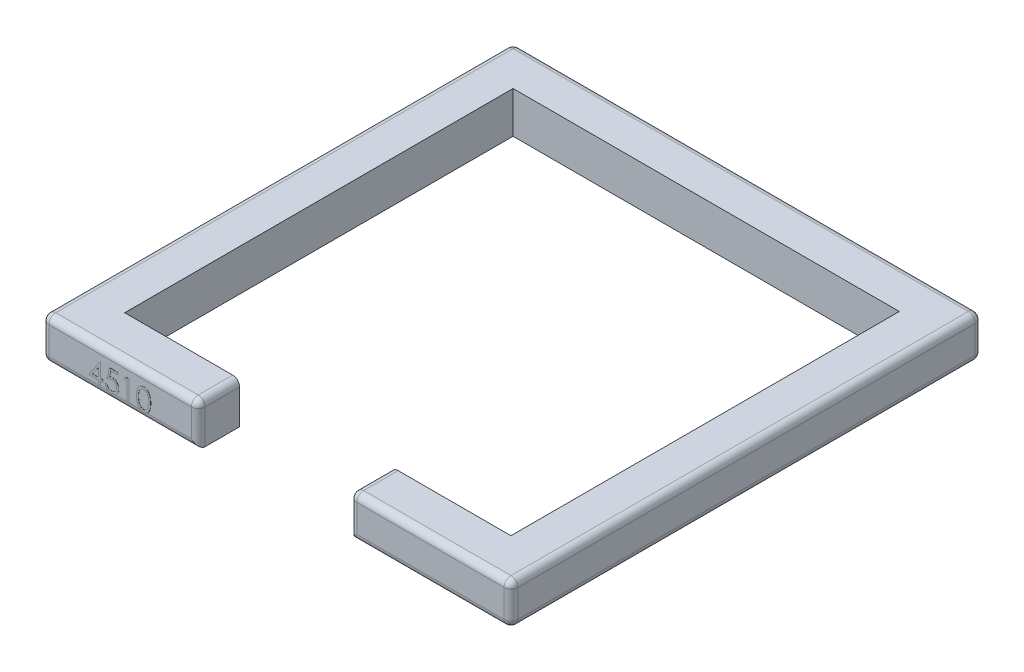
from build123d import *

# Parameters (mm, degrees)
SKETCH2_W           = 863.6
SKETCH2_H           = 867.537
SKETCH2_W_2         = 711.2
SKETCH2_H_2         = 715.137
BOSS_EXTRUDE1_DEPTH = 76.2
SKETCH4_W           = 279.4
SKETCH4_H           = 76.2
CUT_EXTRUDE1_DEPTH  = 617.776127612
FILLET1_R           = 12.7
BOSS_EXTRUDE2_DEPTH = 0.254


with BuildPart() as part:
    # Sketch2 → Boss-Extrude1 (new body)
    with BuildSketch(Plane(origin=(0, 0, 0), x_dir=(1, 0, 0), z_dir=(0, 1, 0))):
        Rectangle(SKETCH2_W, SKETCH2_H)
        Rectangle(SKETCH2_W_2, SKETCH2_H_2, mode=Mode.SUBTRACT)
    extrude(amount=-BOSS_EXTRUDE1_DEPTH)

    # Sketch4 → Cut-Extrude1 (cut, through all)
    with BuildSketch(Plane(origin=(0, 0, 0), x_dir=(1, 0, 0), z_dir=(0, 1, 0))):
        with Locations((-4.378537139, -395.6685)):
            Rectangle(SKETCH4_W, SKETCH4_H)
    extrude(amount=-CUT_EXTRUDE1_DEPTH, mode=Mode.SUBTRACT)

    # Fillet1
    fillet1_edges = [part.edges().sort_by_distance(p)[0] for p in [
        (-431.8, -76.2, 0),
        (-287.93926857, -76.2, 433.7685),
        (283.56073143, 0, 433.7685),
        (283.56073143, -76.2, 433.7685),
        (135.321462861, -38.1, 433.7685),
        (-144.078537139, -38.1, 433.7685),
        (135.321462861, 0, 395.6685),
        (-144.078537139, 0, 395.6685),
        (431.8, -76.2, 0),
        (-287.93926857, 0, 433.7685),
        (-431.8, 0, 0),
        (0, 0, -433.7685),
        (431.8, 0, 0),
        (431.8, -38.1, 433.7685),
        (-431.8, -38.1, 433.7685),
        (-431.8, -38.1, -433.7685),
        (431.8, -38.1, -433.7685),
        (0, -76.2, -433.7685),
    ]]
    fillet(fillet1_edges, radius=FILLET1_R)

    # Sketch5 → Boss-Extrude2 (add)
    # profile 1 of 4: a face of its own
    with BuildSketch(Plane.XY.offset(433.7685)):
        Polygon((-324.291492127, -24.423076923), (-323.596960877, -24.423076923), (-323.596960877, -50.8), (-319.200807031, -50.8), (-319.200807031, -54.707692308), (-323.596960877, -54.707692308), (-323.596960877, -63.5), (-327.016191647, -63.5), (-327.016191647, -54.707692308), (-345.08926857, -54.707692308), align=None)
        Polygon((-327.016191647, -50.8), (-327.016191647, -34.253365385), (-338.372922416, -50.8), align=None, mode=Mode.SUBTRACT)
    # profile 2 of 4: a face of its own
    with BuildSketch(Plane.XY.offset(433.7685)):
        with BuildLine():
            Line((-291.846960877, -25.4), (-291.846960877, -29.307692308))
            Line((-291.846960877, -29.307692308), (-304.80645607, -29.307692308))
            Line((-304.80645607, -29.307692308), (-306.859520974, -39.328786058))
            add(Edge.make_bspline(
                [(-306.859520974, -39.328786058), (-306.456141312, -39.217422242), (-305.674657018, -39.001672462), (-304.521208246, -38.762123932), (-303.426190259, -38.617720098), (-302.715621227, -38.598002689), (-302.371780589, -38.588461538)],
                knots=[0, 0, 0, 0, 1.100273476, 2.13160584, 3.095893838, 4, 4, 4, 4], degree=3))
            add(Edge.make_bspline(
                [(-302.371780589, -38.588461538), (-301.946326165, -38.597670153), (-301.109776469, -38.615776589), (-299.885798217, -38.789641579), (-298.717403008, -39.063307507), (-297.60703435, -39.445619472), (-296.55263807, -39.934493996), (-295.563915186, -40.545181918), (-294.626024762, -41.258559037), (-293.755792525, -42.07874331), (-292.966313628, -42.981404338), (-292.272175283, -43.951951449), (-291.6825768, -44.980952571), (-291.208386868, -46.078239198), (-290.829734544, -47.231680268), (-290.577708543, -48.453412095), (-290.409886654, -49.731918773), (-290.391137248, -50.606091378), (-290.381576262, -51.051862981)],
                knots=[0, 0, 0, 0, 1.052922333, 2.070308379, 3.05430497, 4.020497103, 4.973039431, 5.925935799, 6.892292201, 7.88610001, 8.88166317, 9.857072816, 10.836096531, 11.812156883, 12.81219415, 13.836441305, 14.89672472, 16, 16, 16, 16], degree=3))
            add(Edge.make_bspline(
                [(-290.381576262, -51.051862981), (-290.388816081, -51.362347722), (-290.40319788, -51.979121273), (-290.476334506, -52.895091), (-290.617149015, -53.791669269), (-290.806209097, -54.66897502), (-291.051599419, -55.525347329), (-291.348660263, -56.36323739), (-291.712199876, -57.177430109), (-292.110958561, -57.975629409), (-292.559955936, -58.739790302), (-293.058287688, -59.454426412), (-293.584780607, -60.130258162), (-294.15128826, -60.76003737), (-294.763076235, -61.339625651), (-295.412735303, -61.872462658), (-296.095081473, -62.367559425), (-296.820671396, -62.804818921), (-297.573336711, -63.207187101), (-298.363946732, -63.537280464), (-299.174504643, -63.832397927), (-300.016676574, -64.067633071), (-300.888554934, -64.251956021), (-301.791576919, -64.377148273), (-302.721006498, -64.468331778), (-303.351017349, -64.474039778), (-303.66925655, -64.476923077)],
                knots=[0, 0, 0, 0, 1.056347294, 2.098418968, 3.122841568, 4.141288669, 5.149314143, 6.15115421, 7.162517403, 8.180376062, 9.185164535, 10.17417709, 11.141909838, 12.097768115, 13.052685741, 14.0056014, 14.954263652, 15.917497458, 16.885230207, 17.854509472, 18.828990115, 19.81800267, 20.826176721, 21.857883937, 22.917946725, 24, 24, 24, 24], degree=3))
            add(Edge.make_bspline(
                [(-303.66925655, -64.476923077), (-304.048886918, -64.469402812), (-304.795764817, -64.454607579), (-305.89000299, -64.299829211), (-306.942810555, -64.078153436), (-307.945712514, -63.744655755), (-308.907696841, -63.326782633), (-309.815812712, -62.798649452), (-310.69326416, -62.200162637), (-311.504380903, -61.493893652), (-312.257194595, -60.721925799), (-312.931091163, -59.884186905), (-313.531259527, -58.99450355), (-314.048088716, -58.048555072), (-314.488938605, -57.048827064), (-314.835267477, -55.991573826), (-315.114794713, -54.882319497), (-315.233050804, -54.118648427), (-315.293114724, -53.730769231)],
                knots=[0, 0, 0, 0, 1.0467383, 2.05933395, 3.04377827, 4.011590433, 4.970194871, 5.932262533, 6.905835911, 7.896367577, 8.894135286, 9.877477877, 10.858688626, 11.851381753, 12.8477658, 13.868841284, 14.917554742, 16, 16, 16, 16], degree=3))
            Line((-315.293114724, -53.730769231), (-311.873883954, -53.730769231))
            add(Edge.make_bspline(
                [(-311.873883954, -53.730769231), (-311.789753087, -54.094095756), (-311.628048888, -54.792429512), (-311.273112023, -55.773573542), (-310.839143493, -56.647905662), (-310.3231133, -57.426991697), (-309.707525825, -58.10635821), (-309.005076899, -58.711789656), (-308.217520255, -59.257981778), (-307.342382528, -59.713252472), (-306.419131578, -60.101532331), (-305.452837092, -60.360086496), (-304.469809778, -60.541887644), (-303.804928091, -60.560085954), (-303.47081905, -60.569230769)],
                knots=[0, 0, 0, 0, 1.136247022, 2.183929868, 3.172523383, 4.106158343, 5.02341133, 5.958108904, 6.928429099, 7.938127109, 8.96079061, 9.975095812, 10.982467395, 12, 12, 12, 12], degree=3))
            add(Edge.make_bspline(
                [(-303.47081905, -60.569230769), (-303.144699984, -60.560296015), (-302.502568874, -60.542703412), (-301.557564922, -60.407295881), (-300.64520192, -60.198752033), (-299.774482408, -59.886660183), (-298.930169648, -59.507350534), (-298.13362089, -59.020594994), (-297.361792427, -58.460415936), (-296.638674745, -57.818630906), (-295.976393883, -57.111389374), (-295.391220108, -56.355078319), (-294.903791421, -55.548263504), (-294.493028693, -54.704912897), (-294.181117069, -53.815783461), (-293.958602388, -52.885042097), (-293.827940519, -51.910389884), (-293.809966246, -51.245606826), (-293.800807031, -50.906850962)],
                knots=[0, 0, 0, 0, 1.027316725, 2.022795036, 3.002884548, 3.971462791, 4.93288096, 5.914575861, 6.907176829, 7.935150275, 8.956128384, 9.956726525, 10.942570165, 11.921478529, 12.907843606, 13.90538589, 14.932640048, 16, 16, 16, 16], degree=3))
            add(Edge.make_bspline(
                [(-293.800807031, -50.906850962), (-293.807975051, -50.601226351), (-293.822005428, -50.003009662), (-293.936638208, -49.127806871), (-294.136031536, -48.299697468), (-294.412788629, -47.514682521), (-294.764174127, -46.77202162), (-295.193575413, -46.070948308), (-295.709050973, -45.420702866), (-296.297879818, -44.820981068), (-296.94294592, -44.267498287), (-297.655347804, -43.795666946), (-298.420177293, -43.398731157), (-299.228219504, -43.056179518), (-300.098694543, -42.810154261), (-301.01436417, -42.625446708), (-301.985116334, -42.518599474), (-302.648825824, -42.503774346), (-302.989989724, -42.496153846)],
                knots=[0, 0, 0, 0, 1.045622112, 2.046656509, 3.013763289, 3.955457236, 4.890082067, 5.820317437, 6.762574623, 7.722996705, 8.69280354, 9.665887285, 10.63943826, 11.638615906, 12.663482002, 13.728887084, 14.832589034, 16, 16, 16, 16], degree=3))
            add(Edge.make_bspline(
                [(-302.989989724, -42.496153846), (-303.285307491, -42.502473996), (-303.895063759, -42.515523501), (-304.830395102, -42.611606223), (-305.813285, -42.766611114), (-306.839965652, -42.979821408), (-307.913520326, -43.258833986), (-309.031683488, -43.593183265), (-310.196806162, -43.992928451), (-310.981859104, -44.294813406), (-311.385422416, -44.45)],
                knots=[0, 0, 0, 0, 0.817624296, 1.688186739, 2.600797293, 3.572016777, 4.590301741, 5.671205678, 6.80286297, 8, 8, 8, 8], degree=3))
            Line((-311.385422416, -44.45), (-307.477730108, -25.4))
            Line((-307.477730108, -25.4), (-291.846960877, -25.4))
        make_face()
    # profile 3 of 4: a face of its own
    with BuildSketch(Plane.XY.offset(433.7685)):
        Polygon((-278.376107512, -25.4), (-271.331576262, -25.4), (-271.331576262, -63.5), (-274.750807031, -63.5), (-274.750807031, -29.307692308), (-280.612345493, -29.307692308), align=None)
    # profile 4 of 4: a face of its own
    with BuildSketch(Plane.XY.offset(433.7685)):
        with BuildLine():
            add(Edge.make_bspline(
                [(-257.166191647, -44.465264423), (-257.162620935, -43.854604288), (-257.155684775, -42.668388174), (-257.07852225, -40.939903927), (-256.950339238, -39.318364781), (-256.774672408, -37.80369312), (-256.560898966, -36.395497912), (-256.275524669, -35.097542412), (-255.950991018, -33.903819266), (-255.574862965, -32.810435824), (-255.150453033, -31.8026614), (-254.688525795, -30.861861352), (-254.170749033, -29.989459174), (-253.626714638, -29.171530655), (-253.034400372, -28.42146472), (-252.41066211, -27.72866888), (-251.7311554, -27.109154711), (-251.018979224, -26.544770676), (-250.267685712, -26.050020713), (-249.498689832, -25.614235758), (-248.706698537, -25.241945775), (-247.889549517, -24.949224173), (-247.054587387, -24.707443241), (-246.198893318, -24.542100697), (-245.321054471, -24.438066921), (-244.728529423, -24.428120995), (-244.428030589, -24.423076923)],
                knots=[0, 0, 0, 0, 1.646270934, 3.197905019, 4.663502075, 6.030701355, 7.308322542, 8.50163776, 9.611534131, 10.641858119, 11.616356847, 12.558055219, 13.465016945, 14.349605745, 15.204443733, 16.039544428, 16.859896111, 17.680448484, 18.487036065, 19.28249412, 20.06191084, 20.843045899, 21.620316918, 22.403196591, 23.190181807, 24, 24, 24, 24], degree=3))
            add(Edge.make_bspline(
                [(-244.428030589, -24.423076923), (-244.125021523, -24.42838714), (-243.522431826, -24.43894749), (-242.631540884, -24.540445264), (-241.761231492, -24.70885949), (-240.915214039, -24.947484956), (-240.086539187, -25.243529322), (-239.281688578, -25.61459194), (-238.495662917, -26.046524753), (-237.740953216, -26.55405896), (-237.009274118, -27.119923167), (-236.318597721, -27.75959679), (-235.668861157, -28.466620877), (-235.051909976, -29.233430881), (-234.485247618, -30.074734233), (-233.945605398, -30.9758984), (-233.462584093, -31.952682957), (-232.997386629, -32.988790335), (-232.59584543, -34.112889021), (-232.233718589, -35.318642557), (-231.941121817, -36.620292991), (-231.697398595, -38.011010975), (-231.508587013, -39.495903864), (-231.371071681, -41.071788613), (-231.298430384, -42.739702008), (-231.284750294, -43.880066024), (-231.277730108, -44.465264423)],
                knots=[0, 0, 0, 0, 0.810914788, 1.612654377, 2.396697861, 3.181598691, 3.963628158, 4.749916497, 5.551656086, 6.361998678, 7.18212741, 8.025565596, 8.878627764, 9.750805457, 10.657531673, 11.591944965, 12.560506719, 13.57287815, 14.630710178, 15.753379473, 16.941251878, 18.199788006, 19.531962791, 20.947069417, 22.433333509, 24, 24, 24, 24], degree=3))
            add(Edge.make_bspline(
                [(-231.277730108, -44.465264423), (-231.284823071, -45.047910392), (-231.298643421, -46.183172303), (-231.370257343, -47.84358092), (-231.5113213, -49.411102477), (-231.687778601, -50.889496368), (-231.932173369, -52.272609304), (-232.232675322, -53.565227444), (-232.566325979, -54.772932909), (-232.978184738, -55.885831859), (-233.428969899, -56.919449185), (-233.919427891, -57.884654428), (-234.444879427, -58.789978928), (-235.01734548, -59.628176173), (-235.62752692, -60.40518384), (-236.288483421, -61.107286533), (-236.981583219, -61.751401562), (-237.715415517, -62.324552135), (-238.481895546, -62.826218151), (-239.265221498, -63.274860351), (-240.079292042, -63.636621974), (-240.905658756, -63.947246278), (-241.756141828, -64.184559768), (-242.629681109, -64.348649452), (-243.521833277, -64.463731574), (-244.124918886, -64.472510684), (-244.428030589, -64.476923077)],
                knots=[0, 0, 0, 0, 1.561518951, 3.042555995, 4.452378317, 5.7783523, 7.031515105, 8.214008947, 9.334062868, 10.386615937, 11.391082383, 12.354592575, 13.286541444, 14.194233754, 15.072674879, 15.931287219, 16.775624067, 17.606195743, 18.42308326, 19.229000347, 20.022332153, 20.807536673, 21.593273796, 22.3848459, 23.188221202, 24, 24, 24, 24], degree=3))
            add(Edge.make_bspline(
                [(-244.428030589, -64.476923077), (-244.728521087, -64.471846465), (-245.321029696, -64.461836376), (-246.198988956, -64.358272613), (-247.051149269, -64.191770136), (-247.881715706, -63.958635102), (-248.694949484, -63.673267884), (-249.479769062, -63.301480643), (-250.244900704, -62.873301206), (-250.988303071, -62.385671047), (-251.696006882, -61.826997868), (-252.371994557, -61.20907804), (-252.99928405, -60.516491763), (-253.583129491, -59.760174942), (-254.138018851, -58.947085647), (-254.648443172, -58.066122501), (-255.120565898, -57.120778655), (-255.552113611, -56.104946542), (-255.934731919, -55.003802899), (-256.272708399, -53.804750413), (-256.539562513, -52.497205917), (-256.76797697, -51.091671149), (-256.952210968, -49.582106364), (-257.077988052, -47.967692036), (-257.155726367, -46.24943419), (-257.162639562, -45.070840361), (-257.166191647, -44.465264423)],
                knots=[0, 0, 0, 0, 0.810891512, 1.598919785, 2.382837074, 3.152667961, 3.926044502, 4.706494248, 5.493654104, 6.291793342, 7.103789334, 7.925228297, 8.761435821, 9.622817696, 10.50288917, 11.416980706, 12.369136599, 13.353924996, 14.394355917, 15.514179734, 16.714354668, 17.994756427, 19.357759367, 20.818452758, 22.365282078, 24, 24, 24, 24], degree=3))
        make_face()
        with BuildLine():
            add(Edge.make_bspline(
                [(-253.746960877, -44.45), (-253.745660611, -44.958892978), (-253.743137048, -45.946554323), (-253.677210979, -47.381762393), (-253.587401311, -48.720382258), (-253.47156319, -49.964113612), (-253.299536808, -51.108746605), (-253.106785775, -52.162153727), (-252.872219428, -53.118760222), (-252.594687947, -53.98513039), (-252.278576635, -54.775967393), (-251.933435662, -55.511854906), (-251.562660364, -56.201485985), (-251.147706183, -56.838666122), (-250.695785066, -57.425473223), (-250.217104731, -57.972293483), (-249.693800314, -58.459940623), (-248.969859573, -59.044795816), (-248.014132238, -59.649161243), (-246.809949568, -60.175442964), (-245.572587287, -60.506177704), (-244.732740822, -60.548237447), (-244.313547416, -60.569230769)],
                knots=[0, 0, 0, 0, 1.459021318, 2.831673884, 4.118529203, 5.306027144, 6.411944654, 7.436330062, 8.375795394, 9.233974572, 10.042671642, 10.816086306, 11.563610507, 12.285937304, 12.993564865, 13.685989202, 14.367179055, 15.041617293, 16.353048772, 17.594441528, 18.799311195, 20, 20, 20, 20], degree=3))
            add(Edge.make_bspline(
                [(-244.313547416, -60.569230769), (-243.891642476, -60.551837784), (-243.048703672, -60.517087723), (-241.817161502, -60.181821468), (-240.621580562, -59.675967338), (-239.684626012, -59.077824493), (-238.971801753, -58.50819325), (-238.461076803, -58.022530935), (-237.992315648, -57.478725637), (-237.54772049, -56.891993301), (-237.139951695, -56.251124259), (-236.76915011, -55.559200226), (-236.43078567, -54.814299746), (-236.238010055, -54.294292015), (-236.139448858, -54.028425481)],
                knots=[0, 0, 0, 0, 1.353760809, 2.704726607, 4.075137775, 5.516104923, 6.260822281, 7.007110065, 7.778089737, 8.566572457, 9.372053459, 10.217411131, 11.088608312, 12, 12, 12, 12], degree=3))
            add(Edge.make_bspline(
                [(-236.139448858, -54.028425481), (-236.024585329, -53.68846746), (-235.791363104, -52.998206883), (-235.490789218, -51.927448271), (-235.254075015, -50.804012469), (-235.041113805, -49.634613341), (-234.895756254, -48.410626882), (-234.77875863, -47.135840245), (-234.70984458, -45.809292273), (-234.701302004, -44.908009655), (-234.696960877, -44.45)],
                knots=[0, 0, 0, 0, 0.884706709, 1.796334032, 2.740027952, 3.714592787, 4.726048262, 5.777819803, 6.87074269, 8, 8, 8, 8], degree=3))
            add(Edge.make_bspline(
                [(-234.696960877, -44.45), (-234.70295008, -43.992064425), (-234.714666241, -43.096244545), (-234.759449936, -41.784318064), (-234.875095132, -40.538254724), (-235.003536969, -39.352686436), (-235.192918147, -38.234175998), (-235.397110274, -37.173359818), (-235.67144347, -36.183380034), (-235.964484449, -35.248737158), (-236.299877612, -34.380050034), (-236.669074605, -33.573268531), (-237.063374322, -32.82449767), (-237.491642711, -32.13579182), (-237.948795718, -31.504066139), (-238.446899325, -30.941986695), (-238.966195498, -30.432132842), (-239.693548292, -29.85015459), (-240.645768418, -29.256755848), (-241.830631036, -28.710665719), (-243.063662906, -28.397066876), (-243.89721965, -28.352852512), (-244.313547416, -28.330769231)],
                knots=[0, 0, 0, 0, 1.31362396, 2.569729283, 3.763502607, 4.902122613, 5.988968491, 7.01645872, 7.998833611, 8.933434873, 9.825090667, 10.667526885, 11.477055099, 12.250526234, 12.991942729, 13.710640831, 14.402115721, 15.076753259, 16.378508321, 17.609869233, 18.806226677, 20, 20, 20, 20], degree=3))
            add(Edge.make_bspline(
                [(-244.313547416, -28.330769231), (-244.734939861, -28.352882979), (-245.578492428, -28.39715076), (-246.824340164, -28.709497321), (-248.018550391, -29.253924178), (-248.968252487, -29.852120004), (-249.696112563, -30.421859909), (-250.208641311, -30.91592388), (-250.689203929, -31.456358821), (-251.131900893, -32.048562522), (-251.546529947, -32.684999807), (-251.927323256, -33.370677503), (-252.270411901, -34.109070353), (-252.587017852, -34.899552122), (-252.865395916, -35.765847545), (-253.095018773, -36.721275733), (-253.307149266, -37.771332326), (-253.457320622, -38.922164684), (-253.590820363, -40.166207554), (-253.676614465, -41.508169218), (-253.743357582, -42.94578433), (-253.745735723, -43.938552313), (-253.746960877, -44.45)],
                knots=[0, 0, 0, 0, 1.207732386, 2.417664972, 3.655092373, 4.956220595, 5.625982001, 6.301752483, 6.994047911, 7.697131622, 8.419323945, 9.170223765, 9.943494443, 10.752040957, 11.610060368, 12.549350801, 13.567764191, 14.679664412, 15.874934091, 17.154273443, 18.533957287, 20, 20, 20, 20], degree=3))
        make_face(mode=Mode.SUBTRACT)
    extrude(amount=BOSS_EXTRUDE2_DEPTH)


solid = part.part
